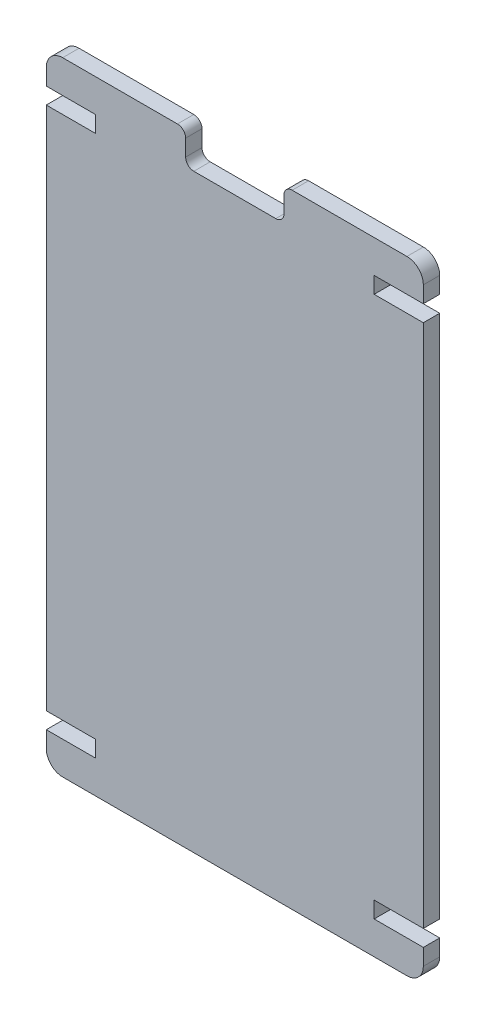
from build123d import *

# Parameters (mm, degrees)
BOSS_EXTRUDE1_DEPTH = 2


with BuildPart() as part:
    # Sketch1 → Boss-Extrude1 (new body)
    with BuildSketch(Plane.XY):
        with BuildLine():
            Line((-21, 38), (-7, 38))
            ThreePointArc((-7, 38), (-6.292893219, 37.707106781), (-6, 37))
            Line((-6, 37), (-6, 35))
            ThreePointArc((-6, 35), (-5.707106781, 34.292893219), (-5, 34))
            Line((-5, 34), (5, 34))
            ThreePointArc((5, 34), (5.707106781, 34.292893219), (6, 35))
            Line((6, 35), (6, 37))
            ThreePointArc((6, 37), (6.292893219, 37.707106781), (7, 38))
            Line((7, 38), (21, 38))
            ThreePointArc((21, 38), (22.414213562, 37.414213562), (23, 36))
            Line((23, 36), (23, 34))
            Line((23, 34), (17, 34))
            Line((17, 34), (17, 32))
            Line((17, 32), (23, 32))
            Line((23, 32), (23, -32))
            Line((23, -32), (17, -32))
            Line((17, -32), (17, -34))
            Line((17, -34), (23, -34))
            Line((23, -34), (23, -36))
            ThreePointArc((23, -36), (22.414213562, -37.414213562), (21, -38))
            Line((21, -38), (-21, -38))
            ThreePointArc((-21, -38), (-22.414213562, -37.414213562), (-23, -36))
            Line((-23, -36), (-23, -34))
            Line((-23, -34), (-17, -34))
            Line((-17, -34), (-17, -32))
            Line((-17, -32), (-23, -32))
            Line((-23, -32), (-23, 32))
            Line((-23, 32), (-17, 32))
            Line((-17, 32), (-17, 34))
            Line((-17, 34), (-23, 34))
            Line((-23, 34), (-23, 36))
            ThreePointArc((-23, 36), (-22.414213562, 37.414213562), (-21, 38))
        make_face()
    extrude(amount=BOSS_EXTRUDE1_DEPTH)


solid = part.part
